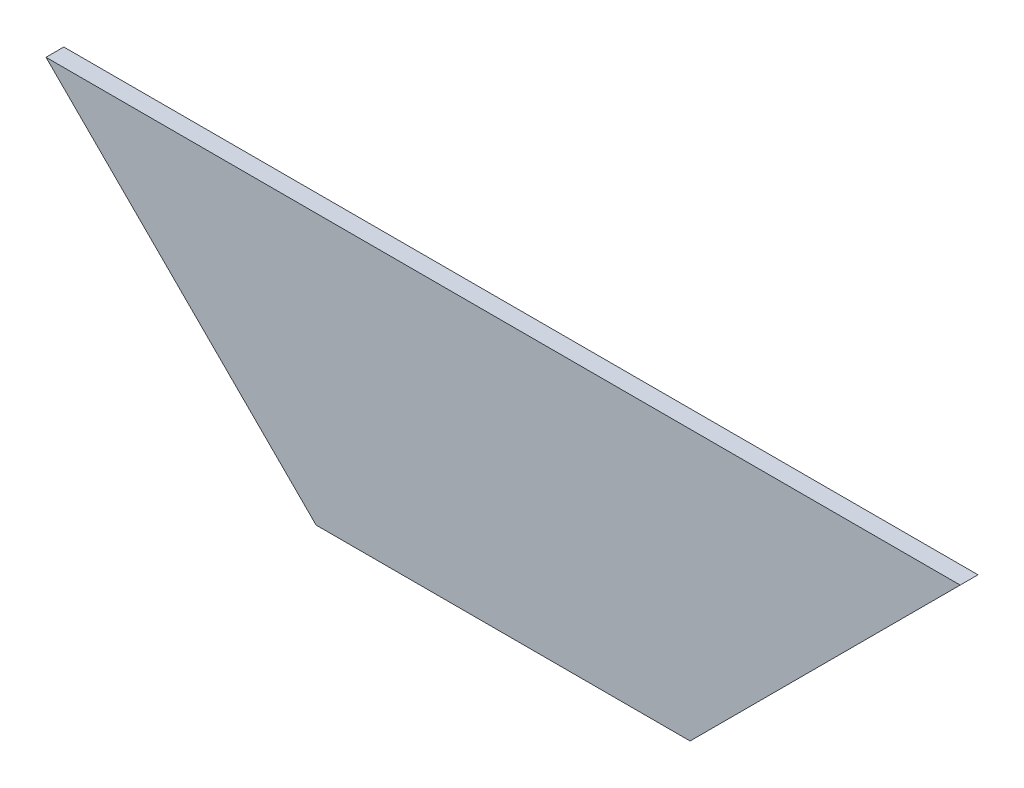
from build123d import *

# Parameters (mm, degrees)
BOSS_EXTRU_1_DEPTH = 6


with BuildPart() as part:
    # Esquisse1 → Boss.-Extru.1 (new body)
    with BuildSketch(Plane.XY):
        Polygon((-63, 0), (63, 0), (154, 91), (-154, 91), align=None)
    extrude(amount=BOSS_EXTRU_1_DEPTH)


solid = part.part
